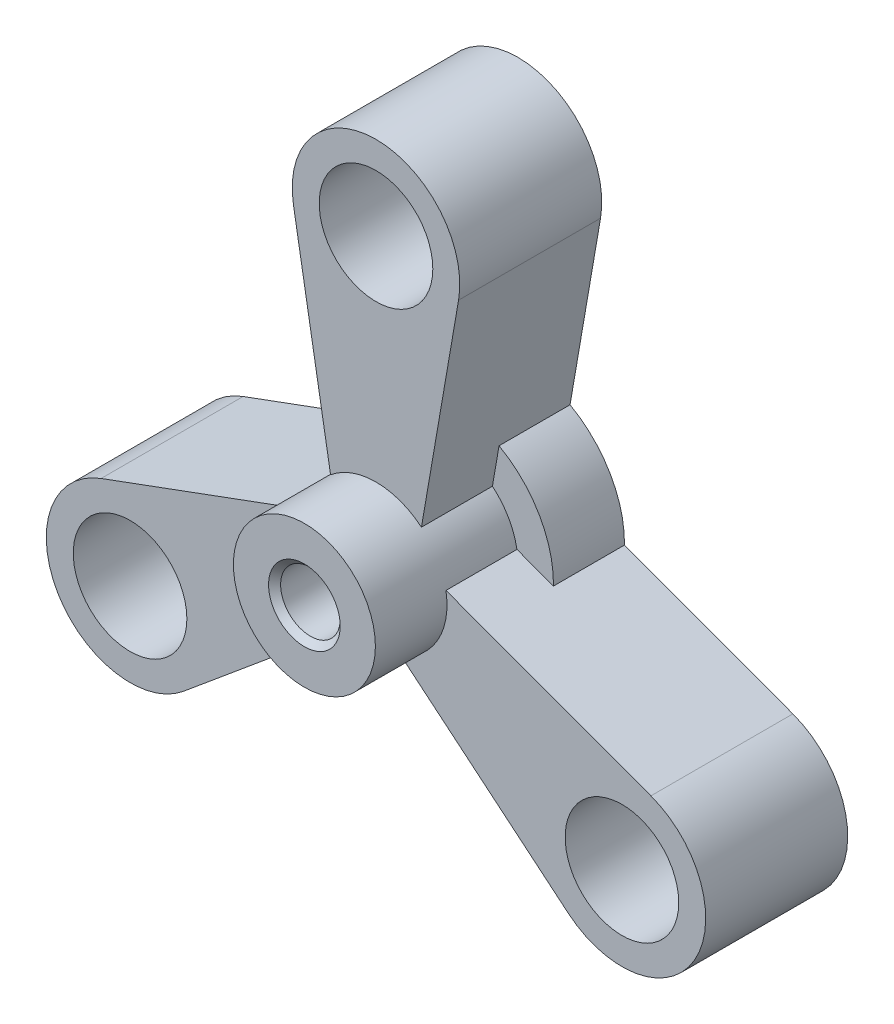
from build123d import *
from build123d.topology import SkipClean

# Parameters (mm, degrees)
BOSS_EXTRUDE1_DEPTH = 5
BOSS_EXTRUDE3_DEPTH = 5
BOSS_EXTRUDE4_DEPTH = 5.043608808
CIRPATTERN1_COUNT   = 3


with BuildPart() as part:
    # Sketch1 → Boss-Extrude1 (new body)
    with BuildSketch(Plane.XY):
        with BuildLine():
            ThreePointArc((0, 16), (-4, 20), (0, 24))
            Line((0, 24), (0, 25.9))
            ThreePointArc((0, 25.9), (-4.51263227, 23.800809124), (-5.814119968, 18.997))
            Line((-5.814119968, 18.997), (-3.665691684, 6.54314179))
            ThreePointArc((-3.665691684, 6.54314179), (-5.268898566, 5.337481419), (-6.495190528, 3.75))
            Line((-6.495190528, 3.75), (0, 0))
            Line((0, 0), (0, 16))
        make_face()
    extrude(amount=BOSS_EXTRUDE1_DEPTH)

    # Sketch2 → Boss-Extrude3 (add)
    with BuildSketch(Plane.XY.offset(5)):
        with BuildLine():
            ThreePointArc((0, 16), (-4, 20), (0, 24))
            Line((0, 24), (0, 25.9))
            ThreePointArc((0, 25.9), (-4.51263227, 23.800809124), (-5.814119968, 18.997))
            Line((-5.814119968, 18.997), (-3.199731749, 3.84209796))
            ThreePointArc((-3.199731749, 3.84209796), (-3.824264635, 3.221024682), (-4.330127019, 2.5))
            Line((-4.330127019, 2.5), (0, 0))
            Line((0, 0), (0, 16))
        make_face()
    extrude(amount=BOSS_EXTRUDE3_DEPTH)

    # Sketch4 → Boss-Extrude4 (add)
    with BuildSketch(Plane.XY.offset(10)):
        with BuildLine():
            Line((0, 0), (0, 5))
            ThreePointArc((0, 5), (-2.5, 4.330127019), (-4.330127019, 2.5))
            Line((-4.330127019, 2.5), (0, 0))
        make_face()
    extrude(amount=BOSS_EXTRUDE4_DEPTH)

    # Mirror1: part across plane


with BuildPart() as part_1:
    with SkipClean():  # the faces are left unmerged after this step: merging them gives an invalid solid
        add(part.part)
        add(part.part.mirror(Plane(origin=(0, 0, 0), x_dir=(0, 0, 1), z_dir=(1, 0, 0))))


with BuildPart() as cirpattern1_1:
    # CirPattern1: pattern copy
    add(part_1.part.rotate(Axis((0, 0, 20.990521912), (0, 0, -1)), 1 * 360 / CIRPATTERN1_COUNT))


with BuildPart() as cirpattern1_2:
    # CirPattern1: pattern copy
    add(part_1.part.rotate(Axis((0, 0, 20.990521912), (0, 0, -1)), 2 * 360 / CIRPATTERN1_COUNT))


with BuildPart() as part_2:
    add(part_1.part)

    # Combine1: union CirPattern1_1, CirPattern1_2
    add(cirpattern1_1.part)
    add(cirpattern1_2.part)

    # Sketch8 → M5 Tapped Hole1 (revolve, cut)
    with SkipClean():  # the faces are left unmerged after this step: merging them gives an invalid solid
        with BuildSketch(Plane(origin=(0, 0, 15.043608808), x_dir=(0, -1, 0), z_dir=(1, 0, 0))):
            Polygon((0, 0), (0, 15.043608808), (2.525, 15.043608808), (2.1, 14.618608808), (2.1, 0.425), (2.525, 0), align=None)
        revolve(axis=Axis((0, 0, 21.393608808), (0, 0, -1)), mode=Mode.SUBTRACT)


solid = part_2.part
